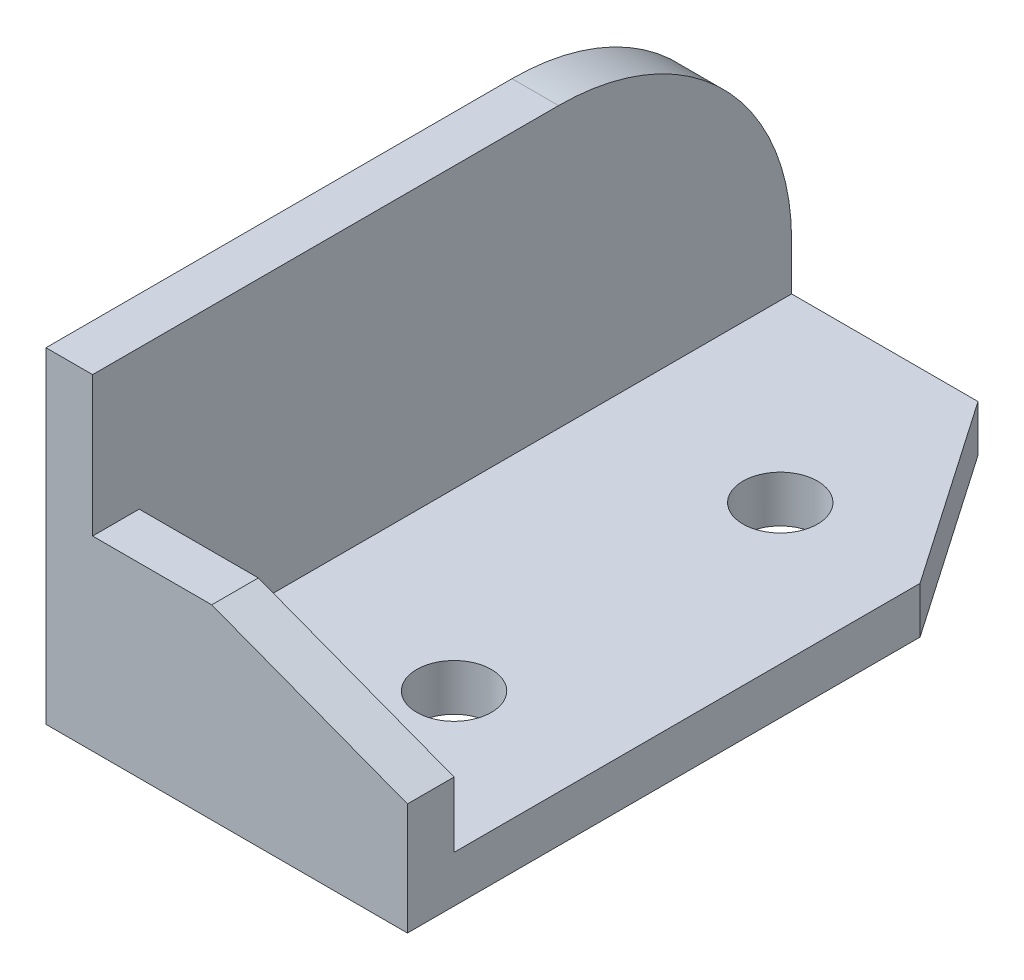
from build123d import *

# Parameters (mm, degrees)
DODANIE_WYCI_GNI_CIE1_DEPTH = 75
ZAOKR_GLENIE1_R             = 25
WYTNIJ_WYCI_GNI_CIE1_DEPTH  = 75
SZKIC6_R                    = 4
WYTNIJ_WYCI_GNI_CIE2_DEPTH  = 15
SZKIC7_W                    = 35
SZKIC7_H                    = 5
DODANIE_WYCI_GNI_CIE2_DEPTH = 15
WYTNIJ_WYCI_GNI_CIE3_DEPTH  = 15


with BuildPart() as part:
    # Szkic1 → Dodanie-wyciągnięcie1 (new body)
    with BuildSketch(Plane.XY):
        Polygon((0, 0), (38.783164401, 0), (38.783164401, 5), (5, 5), (5, 35), (0, 35), align=None)
    extrude(amount=-DODANIE_WYCI_GNI_CIE1_DEPTH)

    # Zaokrąglenie1
    zaokr_glenie1_edges = [part.edges().sort_by_distance(p)[0] for p in [
        (2.5, 35, -75),
    ]]
    fillet(zaokr_glenie1_edges, radius=ZAOKR_GLENIE1_R)

    # Szkic5 → Wytnij-wyciągnięcie1 (cut)
    with BuildSketch(Plane.XZ):
        Polygon((38.783164401, -55), (25, -75), (38.783164401, -75), align=None)
    extrude(amount=-WYTNIJ_WYCI_GNI_CIE1_DEPTH, mode=Mode.SUBTRACT)

    # Szkic6 → Wytnij-wyciągnięcie2 (cut)
    with BuildSketch(Plane(origin=(0, 5, 0), x_dir=(1, 0, 0), z_dir=(0, 1, 0))):
        with Locations(Location((23.783164401, 55, 0), (0, 0, 180))):
            Circle(SZKIC6_R)
        with Locations(Location((23.783164401, 20, 0), (0, 0, 180))):
            Circle(SZKIC6_R)
    extrude(amount=-WYTNIJ_WYCI_GNI_CIE2_DEPTH, mode=Mode.SUBTRACT)

    # Szkic7 → Dodanie-wyciągnięcie2 (add)
    with BuildSketch(Plane(origin=(0, 5, 0), x_dir=(1, 0, 0), z_dir=(0, 1, 0))):
        with Locations((21.283164401, 2.5)):
            Rectangle(SZKIC7_W, SZKIC7_H)
    extrude(amount=DODANIE_WYCI_GNI_CIE2_DEPTH)

    # Szkic8 → Wytnij-wyciągnięcie3 (cut)
    with BuildSketch(Plane(origin=(0, 0, -5), x_dir=(-1, 0, 0), z_dir=(0, 0, -1))):
        Polygon((-38.783164401, 12), (-17.783164401, 20), (-38.783164401, 20), align=None)
    extrude(amount=-WYTNIJ_WYCI_GNI_CIE3_DEPTH, mode=Mode.SUBTRACT)


solid = part.part
